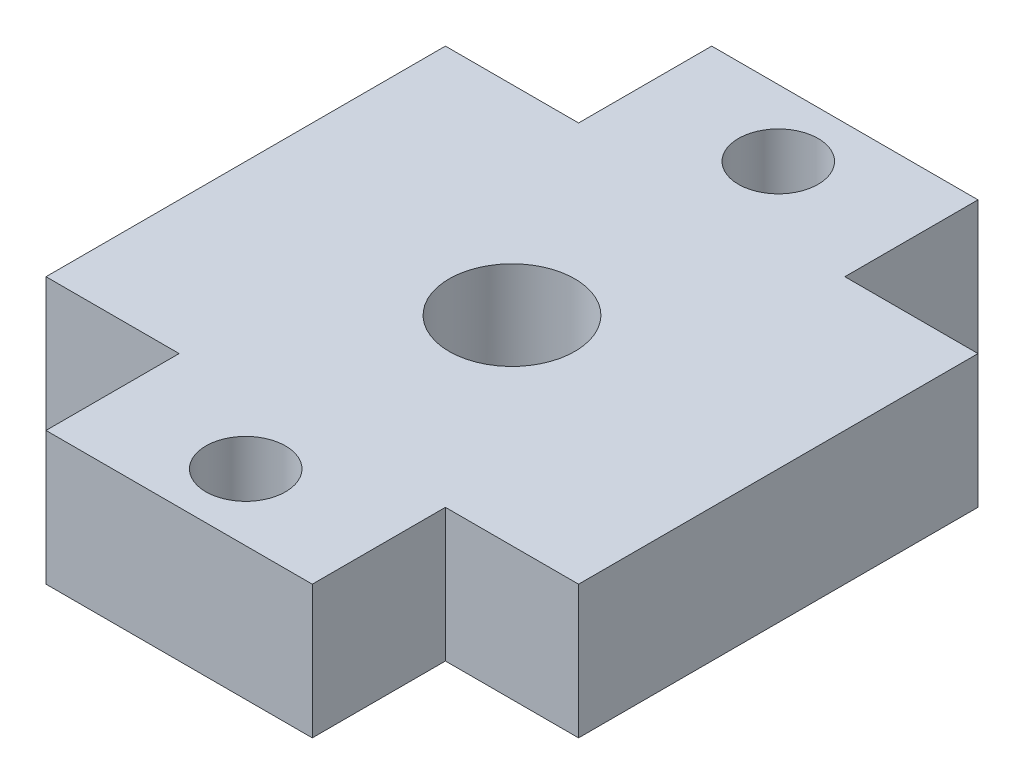
from build123d import *

# Parameters (mm, degrees)
SKETCH1_W               = 25.4
SKETCH1_H               = 31.75
BOSS_EXTRUDE1_DEPTH     = 3.175
CUT_EXTRUDE1_REACH      = 23.299
SKETCH2_W               = 6.35
SKETCH2_H               = 6.35
MIRROR2_COPY_1_REACH    = 23.299
MIRROR2_COPY_1_SKETCH_W = 6.35
MIRROR2_COPY_1_SKETCH_H = 6.35
CUT_EXTRUDE2_REACH      = 23.299
SKETCH5_R               = 3


with BuildPart() as part:
    # Sketch1 → Boss-Extrude1 (new, symmetric)
    with BuildSketch(Plane(origin=(0, 0, 0), x_dir=(1, 0, 0), z_dir=(0, 1, 0))):
        Rectangle(SKETCH1_W, SKETCH1_H)
    extrude(amount=BOSS_EXTRUDE1_DEPTH, both=True)

    # Sketch2 → Cut-Extrude1 (cut, up to next)
    with BuildSketch(Plane(origin=(0, 3.175, 0), x_dir=(1, 0, 0), z_dir=(0, 1, 0)), mode=Mode.PRIVATE) as cut_extrude1_sk1:
        with Locations((-9.525, 12.7)):
            Rectangle(SKETCH2_W, SKETCH2_H)
    cut_extrude1_tool1 = extrude(cut_extrude1_sk1.sketch, amount=-CUT_EXTRUDE1_REACH, mode=Mode.PRIVATE) & part.part
    cut_extrude1 = cut_extrude1_tool1.solids().sort_by_distance((-9.525, 3.175, -12.7))[0]
    add(cut_extrude1, mode=Mode.SUBTRACT)

    # Mirror1: Cut-Extrude1 across plane
    add(cut_extrude1.mirror(Plane.XY), mode=Mode.SUBTRACT)

    # Mirror2: Cut-Extrude1 across plane
    add(cut_extrude1.mirror(Plane(origin=(0, 0, 0), x_dir=(0, 0, 1), z_dir=(1, 0, 0))), mode=Mode.SUBTRACT)

    # Mirror2 copy 1 sketch → Mirror2 copy 1 (cut, up to next)
    with BuildSketch(Plane(origin=(0, 3.175, 0), x_dir=(-1, 0, 0), z_dir=(0, 1, 0)), mode=Mode.PRIVATE) as mirror2_copy_1_sk1:
        with Locations((-9.525, 12.7)):
            Rectangle(MIRROR2_COPY_1_SKETCH_W, MIRROR2_COPY_1_SKETCH_H)
    mirror2_copy_1_tool1 = extrude(mirror2_copy_1_sk1.sketch, amount=-MIRROR2_COPY_1_REACH, mode=Mode.PRIVATE) & part.part
    add(mirror2_copy_1_tool1.solids().sort_by_distance((9.525, 3.175, 12.7))[0], mode=Mode.SUBTRACT)

    # Sketch3 → #6 Clearance Hole1 (revolve, cut)
    with BuildSketch(Plane(origin=(0, 3.175, -12.7), x_dir=(0, 0, 1), z_dir=(1, 0, 0))):
        Polygon((0, 0), (0, 7.490824014), (1.89865, 6.35), (1.89865, 0), align=None)
    f_6_clearance_hole1 = revolve(axis=Axis((0, 9.525, -12.7), (0, -1, 0)), mode=Mode.SUBTRACT)

    # Mirror3: #6 Clearance Hole1 across plane
    add(f_6_clearance_hole1.mirror(Plane.XY), mode=Mode.SUBTRACT)

    # Sketch5 → Cut-Extrude2 (cut, up to next)
    with BuildSketch(Plane(origin=(0, 3.175, 0), x_dir=(1, 0, 0), z_dir=(0, 1, 0)), mode=Mode.PRIVATE) as cut_extrude2_sk1:
        with Locations(Location((0, 0, 0), (0, 0, 270))):
            Circle(SKETCH5_R)
    cut_extrude2_tool1 = extrude(cut_extrude2_sk1.sketch, amount=-CUT_EXTRUDE2_REACH, mode=Mode.PRIVATE) & part.part
    add(cut_extrude2_tool1.solids().sort_by_distance((0, 3.175, 0))[0], mode=Mode.SUBTRACT)


solid = part.part
